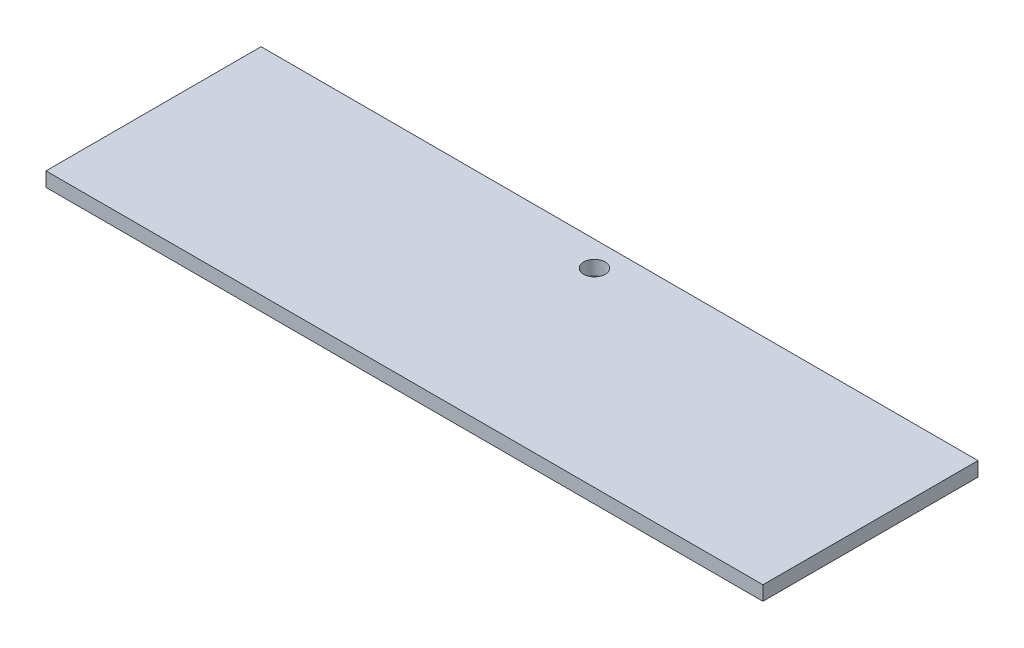
from build123d import *

# Parameters (mm, degrees)
SKETCH1_W           = 635
SKETCH1_H           = 190.5
BOSS_EXTRUDE1_DEPTH = 12.7
SKETCH2_R           = 9.525
CUT_EXTRUDE1_DEPTH  = 332.72293032


with BuildPart() as part:
    # Sketch1 → Boss-Extrude1 (new body)
    with BuildSketch(Plane(origin=(0, 0, 0), x_dir=(1, 0, 0), z_dir=(0, 1, 0))):
        Rectangle(SKETCH1_W, SKETCH1_H)
    extrude(amount=-BOSS_EXTRUDE1_DEPTH)

    # Sketch2 → Cut-Extrude1 (cut, through all)
    with BuildSketch(Plane(origin=(0, 0, 0), x_dir=(1, 0, 0), z_dir=(0, 1, 0))):
        with Locations(Location((0, 73.025, 0), (0, 0, 270))):
            Circle(SKETCH2_R)
    extrude(amount=-CUT_EXTRUDE1_DEPTH, mode=Mode.SUBTRACT)


solid = part.part
